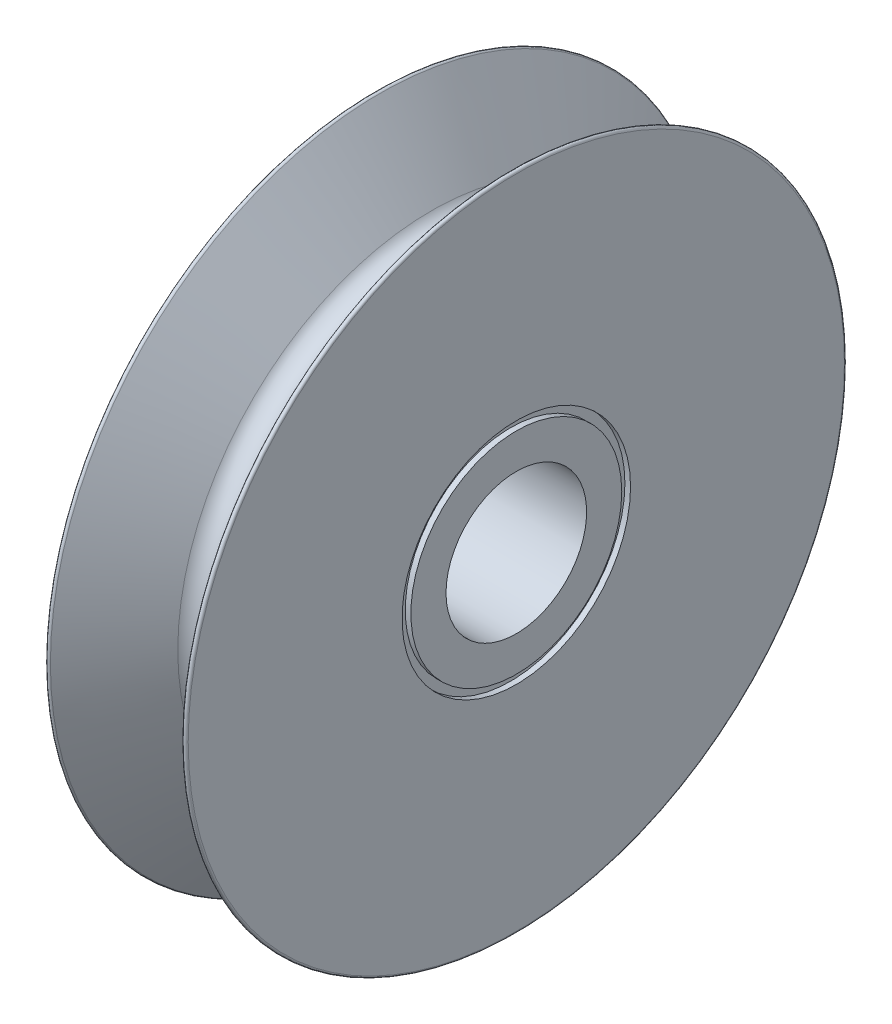
from build123d import *

# Parameters (mm, degrees)
SKETCH4_R          = 5.159375
SKETCH4_R_2        = 4.7625
CUT_EXTRUDE1_DEPTH = 0.254
CUT_EXTRUDE2_START = -0.254
SKETCH5_R          = 5.159375
SKETCH5_R_2        = 4.7625
CUT_EXTRUDE2_DEPTH = 0.254


with BuildPart() as part:
    # Sketch1 → Revolve1 (revolve)
    with BuildSketch(Plane.XY, mode=Mode.PRIVATE) as revolve1_sk:
        with BuildLine():
            Line((0, 3.175), (6.35, 3.175))
            Line((6.35, 3.175), (6.35, 14.816666667))
            ThreePointArc((6.35, 14.816666667), (6.279561395, 14.912197415), (6.167477521, 14.87314711))
            Line((6.167477521, 14.87314711), (3.830022177, 11.457936483))
            ThreePointArc((3.830022177, 11.457936483), (3.175, 11.1125), (2.519977823, 11.457936483))
            Line((2.519977823, 11.457936483), (0.182522479, 14.87314711))
            ThreePointArc((0.182522479, 14.87314711), (0.070438605, 14.912197415), (0, 14.816666667))
            Line((0, 14.816666667), (0, 3.175))
        make_face()
    revolve(revolve1_sk.sketch.rotate(Axis((0, 0, 0), (1, 0, 0)), 90), axis=Axis((0, 0, 0), (1, 0, 0)))

    # Sketch4 → Cut-Extrude1 (cut)
    with BuildSketch(Plane(origin=(6.35, 0, 0), x_dir=(0, 0, -1), z_dir=(1, 0, 0))):
        Circle(SKETCH4_R)
        Circle(SKETCH4_R_2, mode=Mode.SUBTRACT)
    extrude(amount=-CUT_EXTRUDE1_DEPTH, mode=Mode.SUBTRACT)

    # Sketch5 → Cut-Extrude2 (cut)
    with BuildSketch(Plane.ZY.offset(CUT_EXTRUDE2_START)):
        with Locations(Location((0, 0, 0), (0, 0, 180))):
            Circle(SKETCH5_R)
        with Locations(Location((0, 0, 0), (0, 0, 180))):
            Circle(SKETCH5_R_2, mode=Mode.SUBTRACT)
    extrude(amount=CUT_EXTRUDE2_DEPTH, mode=Mode.SUBTRACT)


solid = part.part
